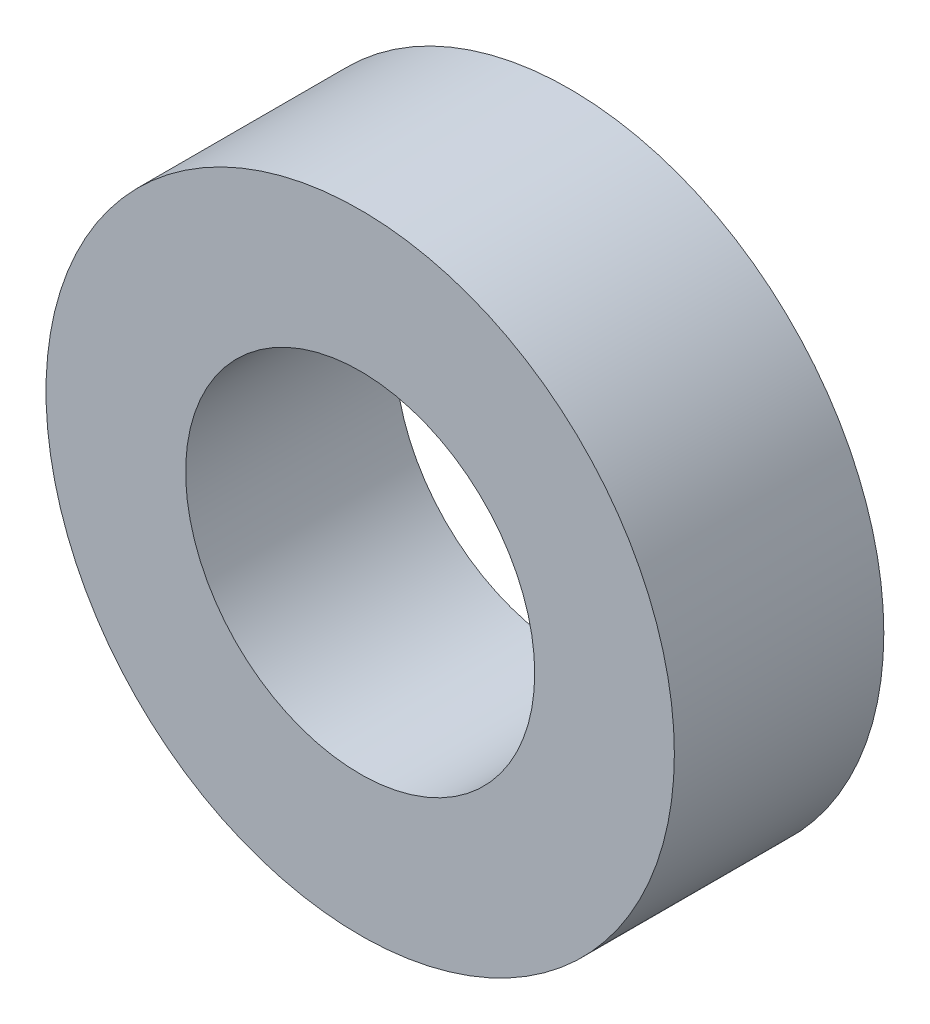
from build123d import *

# Parameters (mm, degrees)
SKETCH1_R           = 9
SKETCH1_R_2         = 5
BOSS_EXTRUDE1_DEPTH = 6


with BuildPart() as part:
    # Sketch1 → Boss-Extrude1 (new body)
    with BuildSketch(Plane.XY):
        Circle(SKETCH1_R)
        Circle(SKETCH1_R_2, mode=Mode.SUBTRACT)
    extrude(amount=BOSS_EXTRUDE1_DEPTH)


solid = part.part
